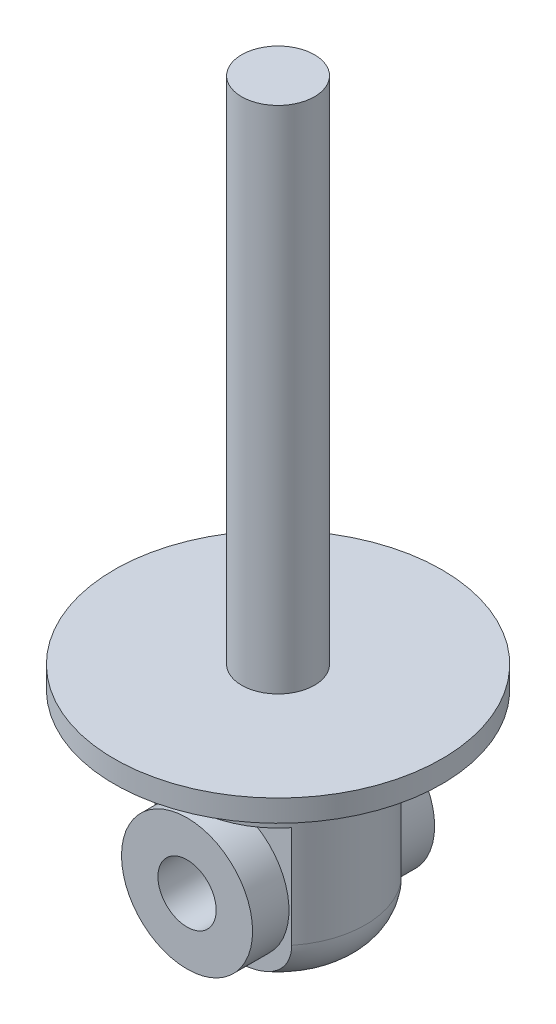
from build123d import *

# Parameters (mm, degrees)
SCHIZZO1_W                    = 5
SCHIZZO1_H                    = 70
SCHIZZO2_R                    = 22.5
ESTRUSIONE_ESTRUSIONE1_DEPTH  = 3
TAGLIO_ESTRUSIONE1_DEPTH      = 77.892782496
TAGLIO_ESTRUSIONE1_DEPTH_BACK = 77.892782496
SCHIZZO5_W                    = 4.5
SCHIZZO5_H                    = 20
SCHIZZO6_R                    = 4
TAGLIO_ESTRUSIONE2_DEPTH      = 80.411900871
ESTRUSIONE_ESTRUSIONE2_START  = 5
SCHIZZO7_R                    = 9
SCHIZZO7_R_2                  = 4
ESTRUSIONE_ESTRUSIONE2_DEPTH  = 5


with BuildPart() as part:
    # Schizzo1 → Rivoluzione1 (revolve)
    with BuildSketch(Plane(origin=(0, 0, 0), x_dir=(0, 0, -1), z_dir=(1, 0, 0)), mode=Mode.PRIVATE) as rivoluzione1_sk:
        with Locations((2.5, 35)):
            Rectangle(SCHIZZO1_W, SCHIZZO1_H)
    revolve(rivoluzione1_sk.sketch.rotate(Axis((0, 70, 0), (0, -1, 0)), 180), axis=Axis((0, 70, 0), (0, -1, 0)))

    # Schizzo2 → Estrusione-Estrusione1 (add)
    with BuildSketch(Plane.XZ):
        with Locations(Location((0, 0, 0), (0, 0, 270))):
            Circle(SCHIZZO2_R)
    extrude(amount=ESTRUSIONE_ESTRUSIONE1_DEPTH)

    # Schizzo4 → Rivoluzione2 (revolve)
    with BuildSketch(Plane.XY, mode=Mode.PRIVATE) as rivoluzione2_sk:
        with BuildLine():
            Line((0, -3), (12, -3))
            Line((12, -3), (12, -25))
            ThreePointArc((12, -25), (10.242640687, -29.242640687), (6, -31))
            Line((6, -31), (0, -31))
            Line((0, -31), (0, -3))
        make_face()
    revolve(rivoluzione2_sk.sketch.rotate(Axis((0, -3, 0), (0, -1, 0)), 180), axis=Axis((0, -3, 0), (0, -1, 0)))

    # Schizzo5 → Taglio-Estrusione1 (cut, two sides: drawn at the far end of the back side and taken through both)
    with BuildSketch(Plane(origin=(0, 0, 0), x_dir=(0, 0, -1), z_dir=(1, 0, 0)).offset(-TAGLIO_ESTRUSIONE1_DEPTH_BACK)):
        with Locations((-9.75, -21)):
            Rectangle(SCHIZZO5_W, SCHIZZO5_H)
        with Locations((9.75, -21)):
            Rectangle(SCHIZZO5_W, SCHIZZO5_H)
    extrude(amount=TAGLIO_ESTRUSIONE1_DEPTH + TAGLIO_ESTRUSIONE1_DEPTH_BACK, mode=Mode.SUBTRACT)

    # Schizzo6 → Taglio-Estrusione2 (cut, through all)
    with BuildSketch(Plane.XY.offset(7.5)):
        with Locations((0, -21)):
            Circle(SCHIZZO6_R)
    extrude(amount=-TAGLIO_ESTRUSIONE2_DEPTH, mode=Mode.SUBTRACT)

    # Schizzo7 → Estrusione-Estrusione2 (add)
    with BuildSketch(Plane.XY.offset(7.5).offset(ESTRUSIONE_ESTRUSIONE2_START)):
        with Locations(Location((0, -21, 0), (0, 0, 180))):
            Circle(SCHIZZO7_R)
        with Locations((0, -21)):
            Circle(SCHIZZO7_R_2, mode=Mode.SUBTRACT)
    estrusione_estrusione2 = extrude(amount=-ESTRUSIONE_ESTRUSIONE2_DEPTH)

    # Specchia1: Estrusione-Estrusione2 across plane
    add(estrusione_estrusione2.mirror(Plane.XY))


solid = part.part
